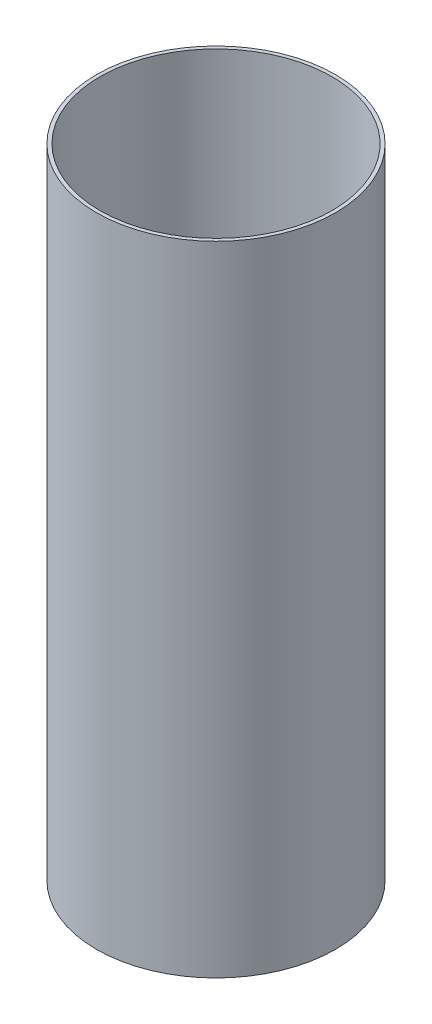
from build123d import *

# Parameters (mm, degrees)
SKETCH1_R           = 76.1746
SKETCH1_R_2         = 73.914
BOSS_EXTRUDE1_DEPTH = 406.4


with BuildPart() as part:
    # Sketch1 → Boss-Extrude1 (new body)
    with BuildSketch(Plane(origin=(0, 0, 0), x_dir=(1, 0, 0), z_dir=(0, 1, 0))):
        with Locations(Location((0, 0, 0), (0, 0, 270))):
            Circle(SKETCH1_R)
        with Locations(Location((0, 0, 0), (0, 0, 270))):
            Circle(SKETCH1_R_2, mode=Mode.SUBTRACT)
    extrude(amount=BOSS_EXTRUDE1_DEPTH)


solid = part.part
